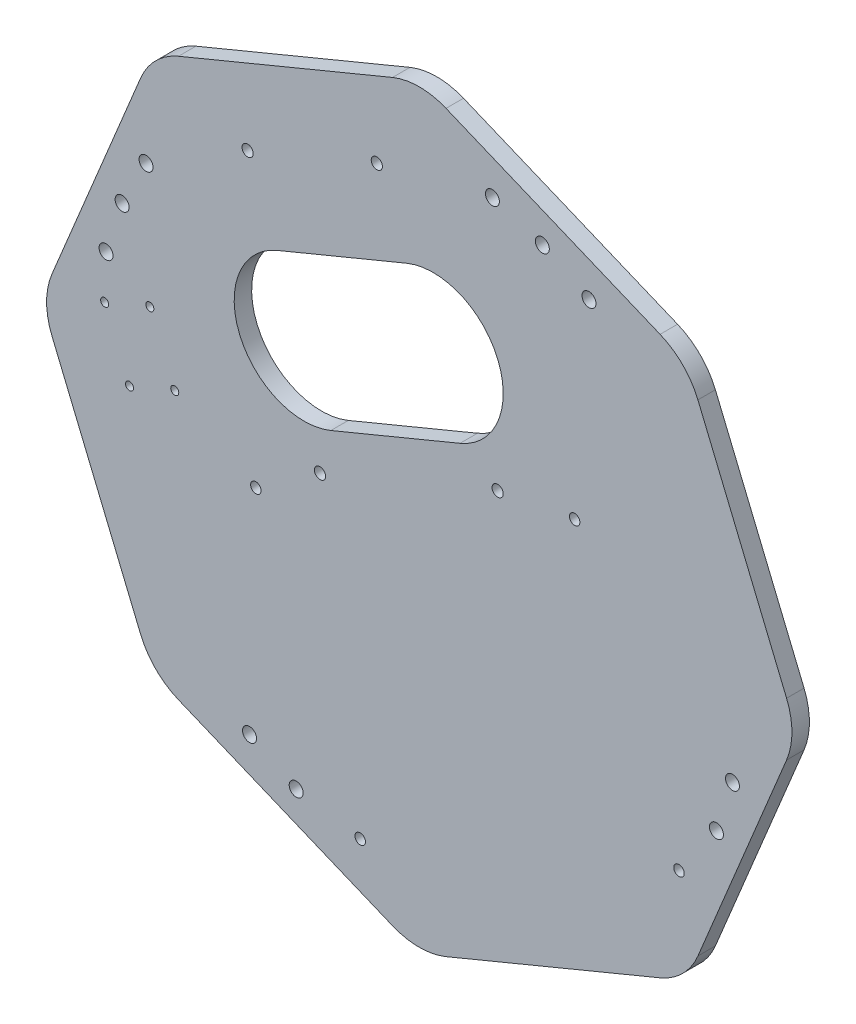
from build123d import *

# Parameters (mm, degrees)
SKETCH_1_R      = 1.5
SKETCH_1_R_2    = 2
SKETCH_1_R_3    = 1.6
SKETCH_1_R_4    = 1.15
EXTRUDE_1_DEPTH = 5
FILLET_1_R      = 20


with BuildPart() as part:
    # 草图1 → 凸台-拉伸1 (new body)
    with BuildSketch(Plane.XY):
        Polygon((0, 108.239220029), (-76.536686473, 76.536686473), (-108.239220029, 0), (-76.536686473, -76.536686473), (0, -108.239220029), (76.536686473, -76.536686473), (108.239220029, 0), (76.536686473, 76.536686473), align=None)
        with Locations((-46.741505227, -16.11378879)):
            Circle(SKETCH_1_R, mode=Mode.SUBTRACT)
        with Locations((-16.892197502, -88.176392326)):
            Circle(SKETCH_1_R, mode=Mode.SUBTRACT)
        with Locations((74.294712357, -50.405537551)):
            Circle(SKETCH_1_R, mode=Mode.SUBTRACT)
        with Locations((44.445404632, 21.657065985)):
            Circle(SKETCH_1_R, mode=Mode.SUBTRACT)
        with Locations((-35.206875778, -84.996916991)):
            Circle(SKETCH_1_R_2, mode=Mode.SUBTRACT)
        with Locations((84.996916991, -35.206875778)):
            Circle(SKETCH_1_R_2, mode=Mode.SUBTRACT)
        with Locations((35.206875778, 84.996916991)):
            Circle(SKETCH_1_R_2, mode=Mode.SUBTRACT)
        with Locations((-84.996916991, 35.206875778)):
            Circle(SKETCH_1_R_2, mode=Mode.SUBTRACT)
        with Locations((22.421756372, 17.730054744)):
            Circle(SKETCH_1_R_3, mode=Mode.SUBTRACT)
        with Locations((-28.391617917, -3.317534036)):
            Circle(SKETCH_1_R_3, mode=Mode.SUBTRACT)
        with Locations((-49.092265239, 66.256693954)):
            Circle(SKETCH_1_R_3, mode=Mode.SUBTRACT)
        with Locations((-12.137083939, 81.564031248)):
            Circle(SKETCH_1_R_3, mode=Mode.SUBTRACT)
        with Locations((-89.991239438, 8.207996367)):
            Circle(SKETCH_1_R_4, mode=Mode.SUBTRACT)
        with Locations((-77.056925983, 13.56556442)):
            Circle(SKETCH_1_R_4, mode=Mode.SUBTRACT)
        with Locations((-69.939014141, -3.618594885)):
            Circle(SKETCH_1_R_4, mode=Mode.SUBTRACT)
        with Locations((-82.873327596, -8.976162938)):
            Circle(SKETCH_1_R_4, mode=Mode.SUBTRACT)
        with Locations((48.55098737, 78.146027573)):
            Circle(SKETCH_1_R_2, mode=Mode.SUBTRACT)
        with Locations((20.926853617, 89.588318422)):
            Circle(SKETCH_1_R_2, mode=Mode.SUBTRACT)
        with Locations((89.588318422, -20.926853617)):
            Circle(SKETCH_1_R_2, mode=Mode.SUBTRACT)
        with Locations((-48.55098737, -78.146027573)):
            Circle(SKETCH_1_R_2, mode=Mode.SUBTRACT)
        with Locations((-78.146027573, 48.55098737)):
            Circle(SKETCH_1_R_2, mode=Mode.SUBTRACT)
        with Locations((-89.588318422, 20.926853617)):
            Circle(SKETCH_1_R_2, mode=Mode.SUBTRACT)
        with BuildLine():
            Line((-40.596693041, 45.746568332), (-3.64151174, 61.053905626))
            ThreePointArc((-3.64151174, 61.053905626), (22.489747557, 50.229983624), (11.665825554, 24.098724326))
            Line((11.665825554, 24.098724326), (-25.289355746, 8.791387031))
            ThreePointArc((-25.289355746, 8.791387031), (-51.420615044, 19.615309034), (-40.596693041, 45.746568332))
        make_face(mode=Mode.SUBTRACT)
    extrude(amount=EXTRUDE_1_DEPTH)

    # 圆角1
    fillet_1_edges = [part.edges().sort_by_distance(p)[0] for p in [
        (76.536686473, 76.536686473, 2.5),
        (108.239220029, 0, 2.5),
        (76.536686473, -76.536686473, 2.5),
        (0, -108.239220029, 2.5),
        (-76.536686473, -76.536686473, 2.5),
        (-108.239220029, 0, 2.5),
        (-76.536686473, 76.536686473, 2.5),
        (0, 108.239220029, 2.5),
    ]]
    fillet(fillet_1_edges, radius=FILLET_1_R)


solid = part.part
